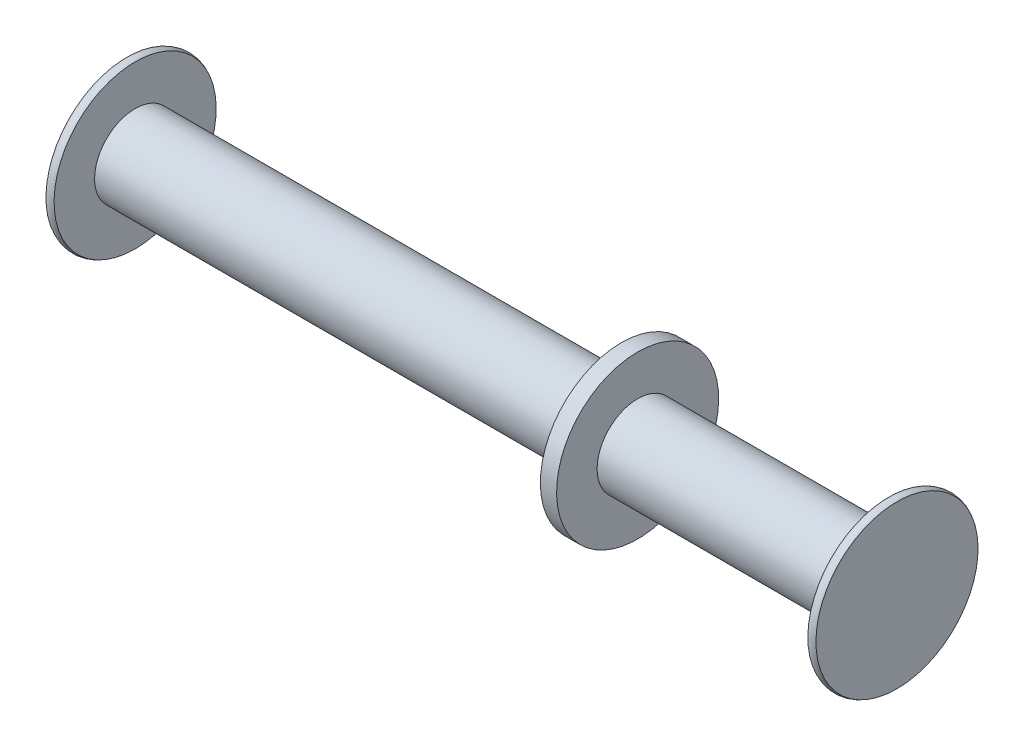
from build123d import *

# Parameters (mm, degrees)
SKETCH2_R           = 10
BOSS_EXTRUDE1_DEPTH = 2


with BuildPart() as part:
    # Sketch1 → Revolve1 (revolve)
    with BuildSketch(Plane.XY):
        with BuildLine():
            Line((-47.5, 0), (47.5, 0))
            Line((47.5, 0), (47.5, -10))
            ThreePointArc((47.5, -10), (47, -10.133974596), (46.5, -10))
            Line((46.5, -10), (46.5, -5))
            Line((46.5, -5), (-46.5, -5))
            Line((-46.5, -5), (-46.5, -10))
            ThreePointArc((-46.5, -10), (-47, -10.133974596), (-47.5, -10))
            Line((-47.5, -10), (-47.5, 0))
        make_face()
    revolve(axis=Axis((-47.5, 0, 0), (1, 0, 0)))

    # Sketch2 → Boss-Extrude1 (add)
    with BuildSketch(Plane(origin=(13.5, 0, 0), x_dir=(0, 0, -1), z_dir=(1, 0, 0))):
        with Locations(Location((0, 0, 0), (0, 0, 90))):
            Circle(SKETCH2_R)
    extrude(amount=BOSS_EXTRUDE1_DEPTH)


solid = part.part
